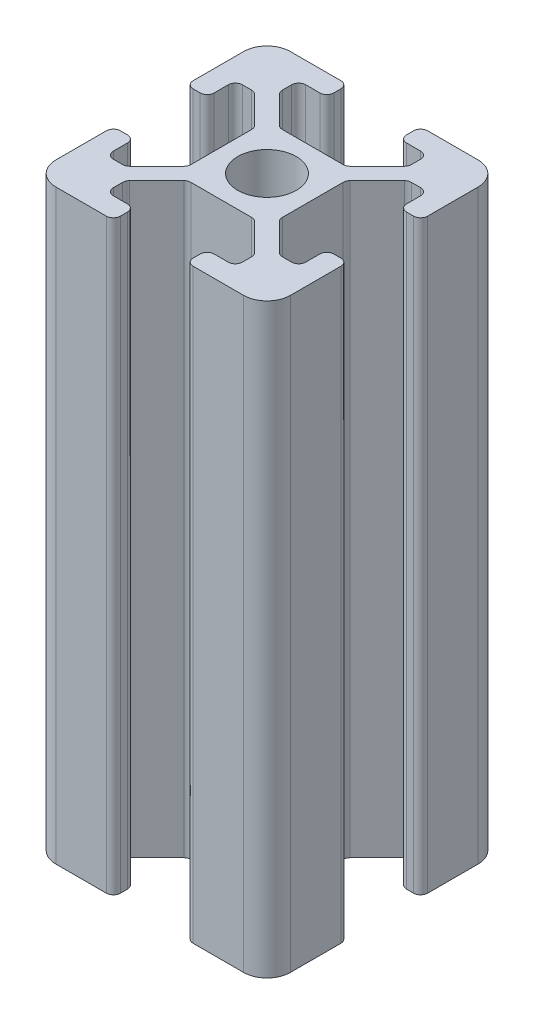
from build123d import *

# Parameters (mm, degrees)
SKETCH_1_R      = 2.5
EXTRUDE_1_DEPTH = 50


with BuildPart() as part:
    # 草图1 → 凸台-拉伸1 (new body)
    with BuildSketch(Plane(origin=(0, 0, 0), x_dir=(1, 0, 0), z_dir=(0, 1, 0))):
        with BuildLine():
            Line((3.1, 8.8), (3.1, 9.4))
            ThreePointArc((3.1, 9.4), (3.275735931, 9.824264069), (3.7, 10))
            Line((3.7, 10), (8, 10))
            ThreePointArc((8, 10), (9.414213562, 9.414213562), (10, 8))
            Line((10, 8), (10, 3.7))
            ThreePointArc((10, 3.7), (9.824264069, 3.275735931), (9.4, 3.1))
            Line((9.4, 3.1), (8.8, 3.1))
            ThreePointArc((8.8, 3.1), (8.375735931, 3.275735931), (8.2, 3.7))
            Line((8.2, 3.7), (8.2, 4.9))
            ThreePointArc((8.2, 4.9), (8.024264069, 5.324264069), (7.6, 5.5))
            Line((7.6, 5.5), (6.809188309, 5.5))
            ThreePointArc((6.809188309, 5.5), (6.57957825, 5.45432772), (6.38492424, 5.324264069))
            Line((6.38492424, 5.324264069), (4.075735931, 3.01507576))
            ThreePointArc((4.075735931, 3.01507576), (3.94567228, 2.82042175), (3.9, 2.590811691))
            Line((3.9, 2.590811691), (3.9, 0))
            Line((3.9, 0), (3.9, -2.590811691))
            ThreePointArc((3.9, -2.590811691), (3.94567228, -2.82042175), (4.075735931, -3.01507576))
            Line((4.075735931, -3.01507576), (6.38492424, -5.324264069))
            ThreePointArc((6.38492424, -5.324264069), (6.57957825, -5.45432772), (6.809188309, -5.5))
            Line((6.809188309, -5.5), (7.6, -5.5))
            ThreePointArc((7.6, -5.5), (8.024264069, -5.324264069), (8.2, -4.9))
            Line((8.2, -4.9), (8.2, -3.7))
            ThreePointArc((8.2, -3.7), (8.375735931, -3.275735931), (8.8, -3.1))
            Line((8.8, -3.1), (9.4, -3.1))
            ThreePointArc((9.4, -3.1), (9.824264069, -3.275735931), (10, -3.7))
            Line((10, -3.7), (10, -8))
            ThreePointArc((10, -8), (9.414213562, -9.414213562), (8, -10))
            Line((8, -10), (3.7, -10))
            ThreePointArc((3.7, -10), (3.275735931, -9.824264069), (3.1, -9.4))
            Line((3.1, -9.4), (3.1, -8.8))
            ThreePointArc((3.1, -8.8), (3.275735931, -8.375735931), (3.7, -8.2))
            Line((3.7, -8.2), (4.9, -8.2))
            ThreePointArc((4.9, -8.2), (5.324264069, -8.024264069), (5.5, -7.6))
            Line((5.5, -7.6), (5.5, -6.809188309))
            ThreePointArc((5.5, -6.809188309), (5.45432772, -6.57957825), (5.324264069, -6.38492424))
            Line((5.324264069, -6.38492424), (3.01507576, -4.075735931))
            ThreePointArc((3.01507576, -4.075735931), (2.82042175, -3.94567228), (2.590811691, -3.9))
            Line((2.590811691, -3.9), (0, -3.9))
            Line((0, -3.9), (-2.590811691, -3.9))
            ThreePointArc((-2.590811691, -3.9), (-2.82042175, -3.94567228), (-3.01507576, -4.075735931))
            Line((-3.01507576, -4.075735931), (-5.324264069, -6.38492424))
            ThreePointArc((-5.324264069, -6.38492424), (-5.45432772, -6.57957825), (-5.5, -6.809188309))
            Line((-5.5, -6.809188309), (-5.5, -7.6))
            ThreePointArc((-5.5, -7.6), (-5.324264069, -8.024264069), (-4.9, -8.2))
            Line((-4.9, -8.2), (-3.7, -8.2))
            ThreePointArc((-3.7, -8.2), (-3.275735931, -8.375735931), (-3.1, -8.8))
            Line((-3.1, -8.8), (-3.1, -9.4))
            ThreePointArc((-3.1, -9.4), (-3.275735931, -9.824264069), (-3.7, -10))
            Line((-3.7, -10), (-8, -10))
            ThreePointArc((-8, -10), (-9.414213562, -9.414213562), (-10, -8))
            Line((-10, -8), (-10, -3.7))
            ThreePointArc((-10, -3.7), (-9.824264069, -3.275735931), (-9.4, -3.1))
            Line((-9.4, -3.1), (-8.8, -3.1))
            ThreePointArc((-8.8, -3.1), (-8.375735931, -3.275735931), (-8.2, -3.7))
            Line((-8.2, -3.7), (-8.2, -4.9))
            ThreePointArc((-8.2, -4.9), (-8.024264069, -5.324264069), (-7.6, -5.5))
            Line((-7.6, -5.5), (-6.809188309, -5.5))
            ThreePointArc((-6.809188309, -5.5), (-6.57957825, -5.45432772), (-6.38492424, -5.324264069))
            Line((-6.38492424, -5.324264069), (-4.075735931, -3.01507576))
            ThreePointArc((-4.075735931, -3.01507576), (-3.94567228, -2.82042175), (-3.9, -2.590811691))
            Line((-3.9, -2.590811691), (-3.9, 0))
            Line((-3.9, 0), (-3.9, 2.590811691))
            ThreePointArc((-3.9, 2.590811691), (-3.94567228, 2.82042175), (-4.075735931, 3.01507576))
            Line((-4.075735931, 3.01507576), (-6.38492424, 5.324264069))
            ThreePointArc((-6.38492424, 5.324264069), (-6.57957825, 5.45432772), (-6.809188309, 5.5))
            Line((-6.809188309, 5.5), (-7.6, 5.5))
            ThreePointArc((-7.6, 5.5), (-8.024264069, 5.324264069), (-8.2, 4.9))
            Line((-8.2, 4.9), (-8.2, 3.7))
            ThreePointArc((-8.2, 3.7), (-8.375735931, 3.275735931), (-8.8, 3.1))
            Line((-8.8, 3.1), (-9.4, 3.1))
            ThreePointArc((-9.4, 3.1), (-9.824264069, 3.275735931), (-10, 3.7))
            Line((-10, 3.7), (-10, 8))
            ThreePointArc((-10, 8), (-9.414213562, 9.414213562), (-8, 10))
            Line((-8, 10), (-3.7, 10))
            ThreePointArc((-3.7, 10), (-3.275735931, 9.824264069), (-3.1, 9.4))
            Line((-3.1, 9.4), (-3.1, 8.8))
            ThreePointArc((-3.1, 8.8), (-3.275735931, 8.375735931), (-3.7, 8.2))
            Line((-3.7, 8.2), (-4.9, 8.2))
            ThreePointArc((-4.9, 8.2), (-5.324264069, 8.024264069), (-5.5, 7.6))
            Line((-5.5, 7.6), (-5.5, 6.809188309))
            ThreePointArc((-5.5, 6.809188309), (-5.45432772, 6.57957825), (-5.324264069, 6.38492424))
            Line((-5.324264069, 6.38492424), (-3.01507576, 4.075735931))
            ThreePointArc((-3.01507576, 4.075735931), (-2.82042175, 3.94567228), (-2.590811691, 3.9))
            Line((-2.590811691, 3.9), (0, 3.9))
            Line((0, 3.9), (2.590811691, 3.9))
            ThreePointArc((2.590811691, 3.9), (2.82042175, 3.94567228), (3.01507576, 4.075735931))
            Line((3.01507576, 4.075735931), (5.324264069, 6.38492424))
            ThreePointArc((5.324264069, 6.38492424), (5.45432772, 6.57957825), (5.5, 6.809188309))
            Line((5.5, 6.809188309), (5.5, 7.6))
            ThreePointArc((5.5, 7.6), (5.324264069, 8.024264069), (4.9, 8.2))
            Line((4.9, 8.2), (3.7, 8.2))
            ThreePointArc((3.7, 8.2), (3.275735931, 8.375735931), (3.1, 8.8))
        make_face()
        with Locations(Location((0, 0, 0), (0, 0, 270))):
            Circle(SKETCH_1_R, mode=Mode.SUBTRACT)
    extrude(amount=EXTRUDE_1_DEPTH)


solid = part.part
